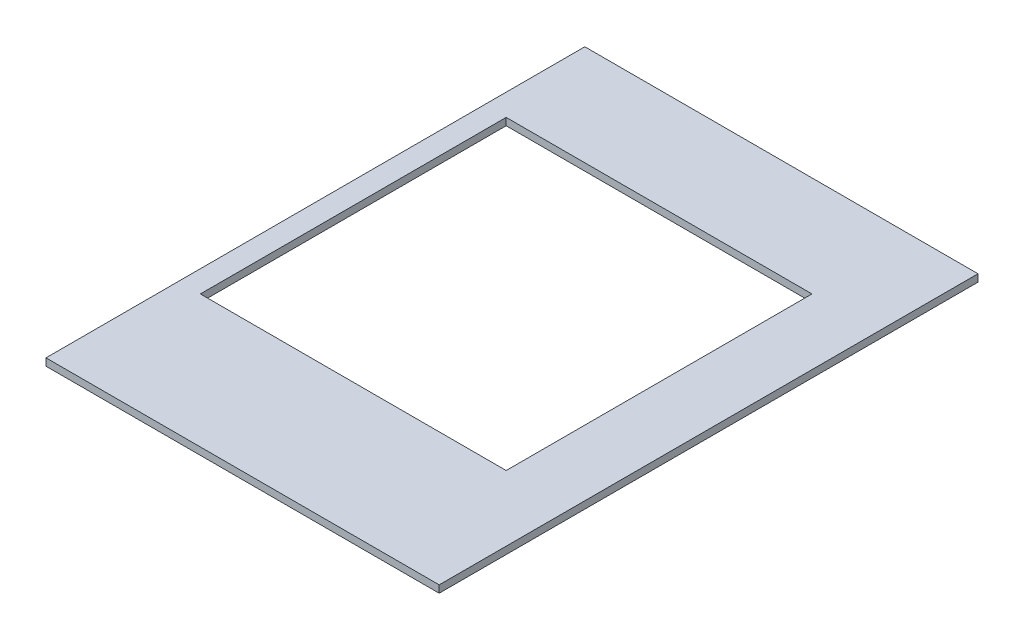
from build123d import *

# Parameters (mm, degrees)
SKETCH1_W           = 270
SKETCH1_H           = 370
SKETCH1_W_2         = 210
SKETCH1_H_2         = 210
BOSS_EXTRUDE1_DEPTH = 5


with BuildPart() as part:
    # Sketch1 → Boss-Extrude1 (new body)
    with BuildSketch(Plane(origin=(0, 0, 0), x_dir=(1, 0, 0), z_dir=(0, 1, 0))):
        with Locations((135, 185)):
            Rectangle(SKETCH1_W, SKETCH1_H)
        with Locations((120, 196)):
            Rectangle(SKETCH1_W_2, SKETCH1_H_2, mode=Mode.SUBTRACT)
    extrude(amount=BOSS_EXTRUDE1_DEPTH)


solid = part.part
